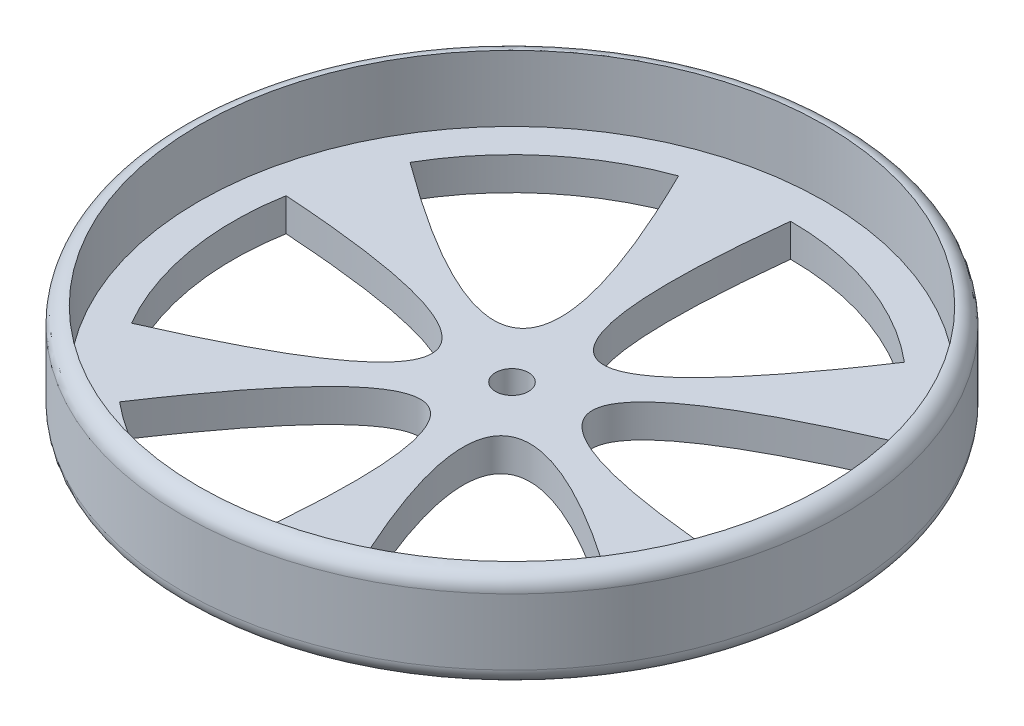
from build123d import *

# Parameters (mm, degrees)
SKETCH1_R           = 25.4
BOSS_EXTRUDE2_DEPTH = 7.62
CUT_EXTRUDE2_DEPTH  = 47.498
SKETCH1_5_R         = 1.27
CUT_EXTRUDE5_DEPTH  = 61.214
FILLET3_R           = 1.27
FILLET4_R           = 1.27
SKETCH9_R           = 24.13
CUT_EXTRUDE7_DEPTH  = 5.08


with BuildPart() as part:
    # Sketch1 → Boss-Extrude2 (new body)
    with BuildSketch(Plane(origin=(0, 0, 0), x_dir=(1, 0, 0), z_dir=(0, 1, 0))):
        Circle(SKETCH1_R)
    extrude(amount=BOSS_EXTRUDE2_DEPTH)

    # Sketch1<4> → Cut-Extrude2 (cut)
    with BuildSketch(Plane(origin=(0, 0, 0), x_dir=(1, 0, 0), z_dir=(0, 1, 0))):
        with BuildLine():
            ThreePointArc((21.140811888, -3.72769553), (21.140811888, 3.72769553), (18.590917969, 10.733471494))
            add(Edge.make_bspline(
                [(18.590917969, 10.733471494), (-9.834419754, -1.734073542), (21.140811888, -3.72769553)],
                knots=[0, 0, 0, 1, 1, 1], degree=2))
        make_face()
        with BuildLine():
            add(Edge.make_bspline(
                [(0, 21.466942988), (-3.415458137, -9.38389411), (13.79868497, 16.444632387)],
                knots=[0, 0, 0, 1, 1, 1], degree=2))
            ThreePointArc((13.79868497, 16.444632387), (7.342126917, 20.172327916), (0, 21.466942988))
        make_face()
        with BuildLine():
            ThreePointArc((7.342126917, -20.172327916), (13.79868497, -16.444632387), (18.590917969, -10.733471494))
            add(Edge.make_bspline(
                [(18.590917969, -10.733471494), (-6.418961617, 7.649820567), (7.342126917, -20.172327916)],
                knots=[0, 0, 0, 1, 1, 1], degree=2))
        make_face()
        with BuildLine():
            add(Edge.make_bspline(
                [(-18.590917969, 10.733471494), (6.418961617, -7.649820567), (-7.342126917, 20.172327916)],
                knots=[0, 0, 0, 1, 1, 1], degree=2))
            ThreePointArc((-7.342126917, 20.172327916), (-13.79868497, 16.444632387), (-18.590917969, 10.733471494))
        make_face()
        with BuildLine():
            ThreePointArc((-13.79868497, -16.444632387), (-7.342126917, -20.172327916), (0, -21.466942988))
            add(Edge.make_bspline(
                [(0, -21.466942988), (3.415458137, 9.38389411), (-13.79868497, -16.444632387)],
                knots=[0, 0, 0, 1, 1, 1], degree=2))
        make_face()
        with BuildLine():
            add(Edge.make_bspline(
                [(-18.590917969, -10.733471494), (9.834419754, 1.734073542), (-21.140811888, 3.72769553)],
                knots=[0, 0, 0, 1, 1, 1], degree=2))
            ThreePointArc((-21.140811888, 3.72769553), (-21.140811888, -3.72769553), (-18.590917969, -10.733471494))
        make_face()
    extrude(amount=CUT_EXTRUDE2_DEPTH, mode=Mode.SUBTRACT)

    # Sketch1<5> → Cut-Extrude5 (cut)
    with BuildSketch(Plane(origin=(0, 0, 0), x_dir=(1, 0, 0), z_dir=(0, 1, 0))):
        Circle(SKETCH1_5_R)
    extrude(amount=CUT_EXTRUDE5_DEPTH, mode=Mode.SUBTRACT)

    # Fillet3
    fillet3_edges = [part.edges().sort_by_distance(p)[0] for p in [
        (-25.4, 0, 0),
    ]]
    fillet(fillet3_edges, radius=FILLET3_R)

    # Fillet4
    fillet4_edges = [part.edges().sort_by_distance(p)[0] for p in [
        (-25.4, 7.62, 0),
    ]]
    fillet(fillet4_edges, radius=FILLET4_R)

    # Sketch9 → Cut-Extrude7 (cut)
    with BuildSketch(Plane(origin=(0, 7.62, 0), x_dir=(1, 0, 0), z_dir=(0, 1, 0))):
        Circle(SKETCH9_R)
    extrude(amount=-CUT_EXTRUDE7_DEPTH, mode=Mode.SUBTRACT)


solid = part.part
